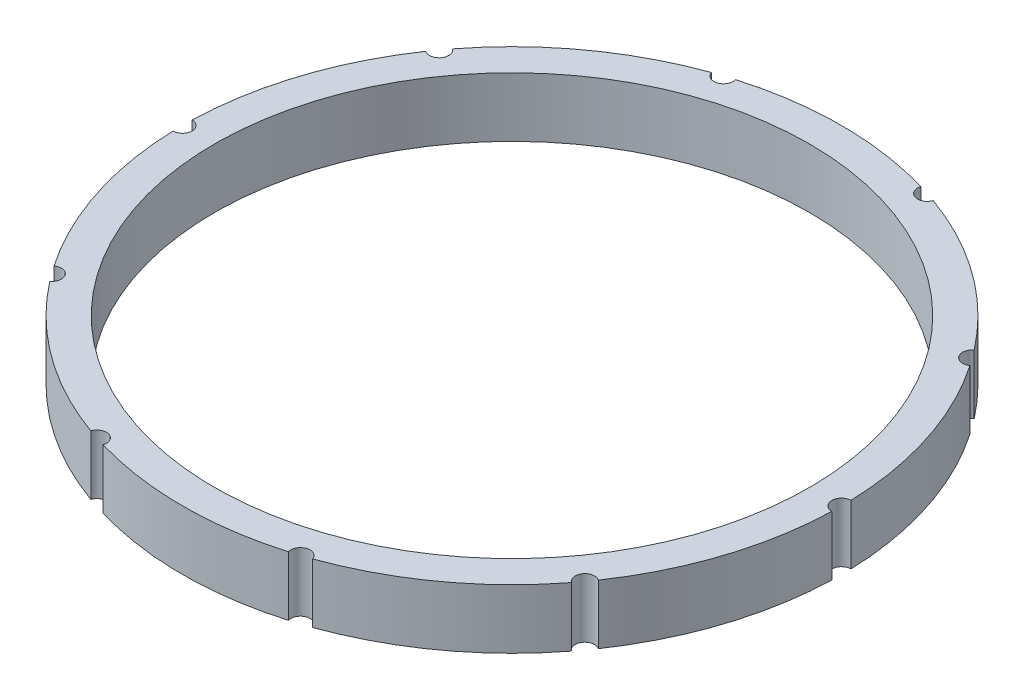
from build123d import *

# Parameters (mm, degrees)
SKETCH_1_R               = 72.1
SKETCH_1_R_2             = 65.1
EXTRUDE_1_DEPTH          = 13
SKETCH_2_R               = 2.1
CUT_EXTRUDE_1_DEPTH      = 13
PATTERN_CIRCULAR_1_COUNT = 10


with BuildPart() as part:
    # 草图1 → 凸台-拉伸1 (new body)
    with BuildSketch(Plane(origin=(0, 0, 0), x_dir=(1, 0, 0), z_dir=(0, 1, 0))):
        with Locations(Location((0, 0, 0), (0, 0, 90))):
            Circle(SKETCH_1_R)
        with Locations(Location((0, 0, 0), (0, 0, 90))):
            Circle(SKETCH_1_R_2, mode=Mode.SUBTRACT)
    extrude(amount=EXTRUDE_1_DEPTH)

    # 草图2 → 切除-拉伸1 (cut)
    with BuildSketch(Plane(origin=(0, 13, 0), x_dir=(1, 0, 0), z_dir=(0, 1, 0))):
        with Locations((-72.1, 0)):
            Circle(SKETCH_2_R)
    cut_extrude_1 = extrude(amount=-CUT_EXTRUDE_1_DEPTH, mode=Mode.SUBTRACT)

    # 阵列(圆周)1: 切除-拉伸1 ×10 about axis
    pattern_circular_1_axis = Axis((0, 0, 0), (0, 1, 0))
    for i in range(1, PATTERN_CIRCULAR_1_COUNT):
        add(cut_extrude_1.rotate(pattern_circular_1_axis, i * 360 / PATTERN_CIRCULAR_1_COUNT), mode=Mode.SUBTRACT)


solid = part.part
